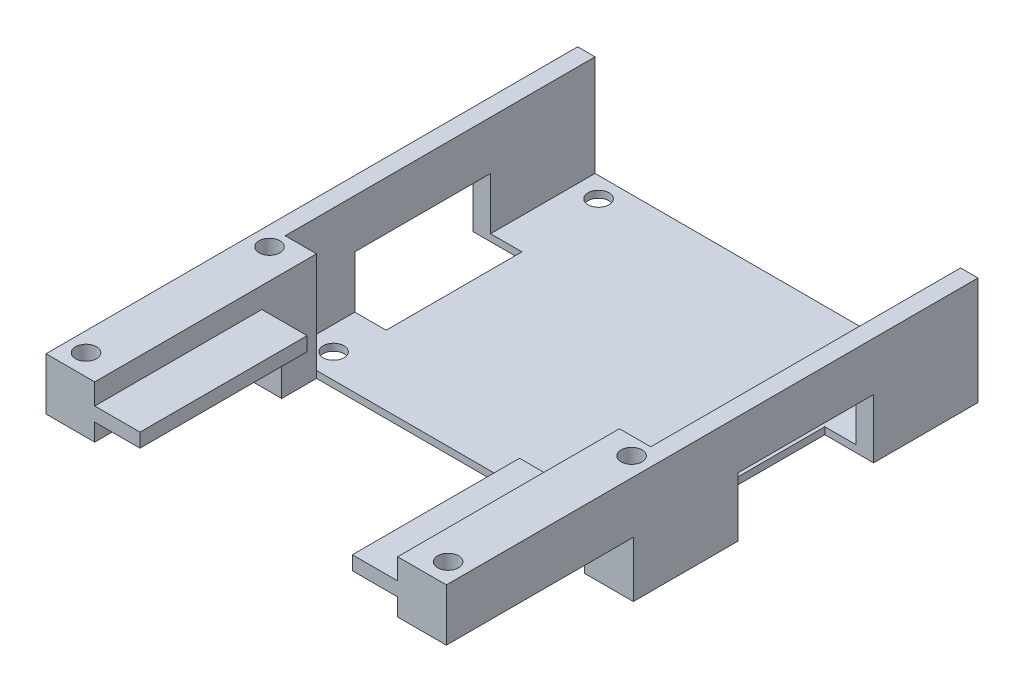
from build123d import *

# Parameters (mm, degrees)
SKETCH1_W                = 52.5
SKETCH1_H                = 44.5
BOSS_EXTRUDE1_DEPTH      = 1
BOSS_EXTRUDE2_DEPTH      = 15.5
F_3_0_3_DIAMETER_HOLE1_D = 3
SKETCH6_W                = 6.5
SKETCH6_H                = 2
BOSS_EXTRUDE3_DEPTH      = 24
SKETCH6_4_W              = 7
SKETCH6_4_H              = 8
CUT_EXTRUDE1_DEPTH       = 26.85
SKETCH8_W                = 7
SKETCH8_H                = 19.5
CUT_EXTRUDE2_DEPTH       = 8.5
CUT_EXTRUDE3_DEPTH       = 0.3


with BuildPart() as part:
    # Sketch1 → Boss-Extrude1 (new body)
    with BuildSketch(Plane(origin=(0, 0, 0), x_dir=(1, 0, 0), z_dir=(0, 1, 0))):
        with Locations((0, 54.1)):
            Rectangle(SKETCH1_W, SKETCH1_H)
    extrude(amount=BOSS_EXTRUDE1_DEPTH)

    # Sketch1<3> → Boss-Extrude2 (add)
    with BuildSketch(Plane(origin=(0, 0, 0), x_dir=(1, 0, 0), z_dir=(0, 1, 0))):
        Polygon((-26.25, 76.35), (-28.75, 76.35), (-28.75, 0), (-21.75, 0), (-21.75, 31.85), (-26.25, 31.85), align=None)
        Polygon((28.75, 76.35), (26.25, 76.35), (26.25, 31.85), (21.75, 31.85), (21.75, 0), (28.75, 0), align=None)
    extrude(amount=BOSS_EXTRUDE2_DEPTH)

    # Ø3.0 (3) Diameter Hole1 (through all)
    with Locations(Plane(origin=(0, 0, 0), x_dir=(-1, 0, 0), z_dir=(0, -1, 0))):
        with Locations((-22.85, 73.45), (22.85, 73.45), (26, 29.35), (22.85, 35.4), (-22.85, 35.4), (-26, 29.35), (-26, 3), (26, 3), (-30.25, 71.35), (30.25, 71.35)):
            Hole(F_3_0_3_DIAMETER_HOLE1_D / 2)

    # Sketch6 → Boss-Extrude3 (add)
    with BuildSketch(Plane.XY):
        with Locations((-18.5, 11.5)):
            Rectangle(SKETCH6_W, SKETCH6_H)
        with Locations((18.5, 11.5)):
            Rectangle(SKETCH6_W, SKETCH6_H)
    extrude(amount=-BOSS_EXTRUDE3_DEPTH)

    # Sketch6<4> → Cut-Extrude1 (cut)
    with BuildSketch(Plane.XY):
        with Locations((-25.25, 4)):
            Rectangle(SKETCH6_4_W, SKETCH6_4_H)
        with Locations((25.25, 4)):
            Rectangle(SKETCH6_4_W, SKETCH6_4_H)
    extrude(amount=-CUT_EXTRUDE1_DEPTH, mode=Mode.SUBTRACT)

    # Sketch8 → Cut-Extrude2 (cut)
    with BuildSketch(Plane.XZ):
        with Locations((-25.25, -51.6)):
            Rectangle(SKETCH8_W, SKETCH8_H)
        with Locations((25.25, -51.6)):
            Rectangle(SKETCH8_W, SKETCH8_H)
    extrude(amount=-CUT_EXTRUDE2_DEPTH, mode=Mode.SUBTRACT)

    # Sketch9 → Cut-Extrude3 (cut)
    with BuildSketch(Plane.XZ):
        Polygon((-10.502040481, -57.1), (4.24240096, -39.528258941), (2.025663817, -52.1), (10.502040481, -52.1), (-4.24240096, -69.671741059), (-2.025663817, -57.1), align=None)
        Polygon((-3.425965173, -67.920888862), (-1.429787021, -56.6), (-9.429787021, -56.6), (3.425965173, -41.279111138), (1.429787021, -52.6), (9.429787021, -52.6), align=None, mode=Mode.SUBTRACT)
    extrude(amount=-CUT_EXTRUDE3_DEPTH, mode=Mode.SUBTRACT)


solid = part.part
